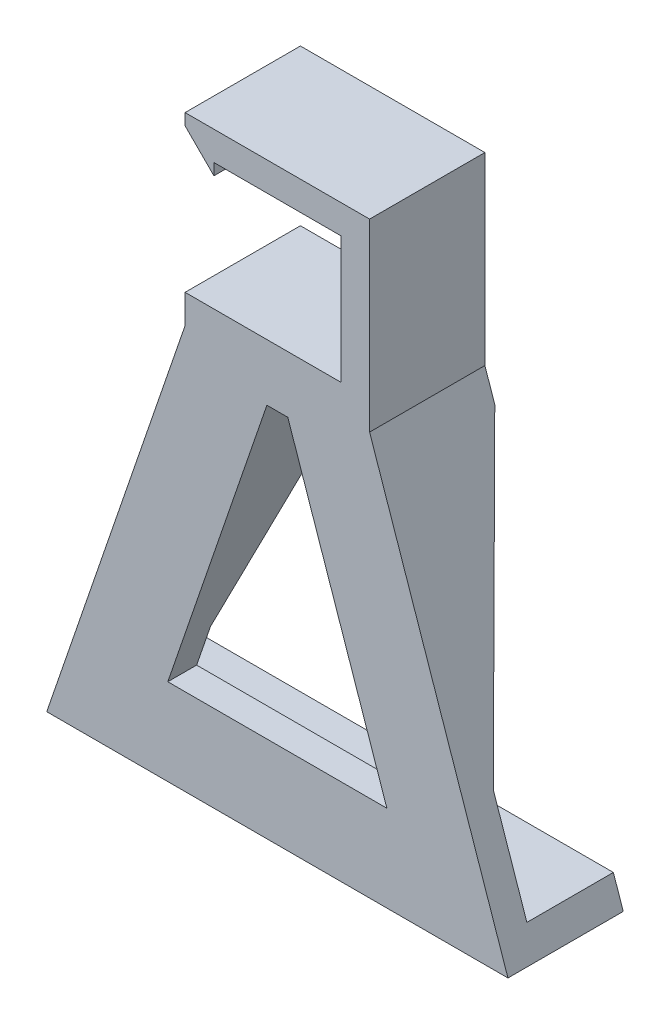
from build123d import *

# Parameters (mm, degrees)
BOSS_EXTRUDE1_DEPTH     = 20
CUT_EXTRUDE1_DEPTH      = 97.932966679
CUT_EXTRUDE1_DEPTH_BACK = 97.932966679
CUT_EXTRUDE3_DEPTH      = 97.932966679


with BuildPart() as part:
    # Sketch2 → Boss-Extrude1 (new body)
    with BuildSketch(Plane.XY):
        Polygon((16, 16), (16, -16), (-16, -16), (-16, -11), (-11, -11), (11, -11), (11, 11), (-11, 11), (-11, 9), (-16, 14), (-16, 16), align=None)
    extrude(amount=BOSS_EXTRUDE1_DEPTH)

    # Sketch3 → Loft1 section 0
    with BuildSketch(Plane.XZ.offset(16)):
        with BuildLine():
            Line((-16, 0), (16, 0))
            Line((16, 0), (16, 20))
            Line((16, 20), (-16, 20))
            Line((-16, 20), (-16, 0))
        make_face()
    # Sketch4 → Loft1 section 1
    with BuildSketch(Plane(origin=(0, -86, 0), x_dir=(-1, 0, 0), z_dir=(0, -1, 0))):
        with BuildLine():
            Line((40, 0), (-40, 0))
            Line((-40, 0), (-40, -20))
            Line((-40, -20), (40, -20))
            Line((40, -20), (40, 0))
        make_face()
    loft()

    # Sketch5 → Cut-Extrude1 (cut, two sides: drawn at the far end of the back side and taken through both)
    with BuildSketch(Plane(origin=(0, 0, 0), x_dir=(0, 0, -1), z_dir=(1, 0, 0)).offset(-CUT_EXTRUDE1_DEPTH_BACK)):
        Polygon((0, -81), (-15, -81), (-15, -64), (0, -21), align=None)
    extrude(amount=CUT_EXTRUDE1_DEPTH + CUT_EXTRUDE1_DEPTH_BACK, mode=Mode.SUBTRACT)

    # Sketch6 → Cut-Extrude3 (cut, through all)
    with BuildSketch(Plane.XY):
        Polygon((-1.810810811, -20.864864865), (1.810810811, -20.864864865), (19, -71), (-19, -71), align=None)
    extrude(amount=CUT_EXTRUDE3_DEPTH, mode=Mode.SUBTRACT)


solid = part.part
